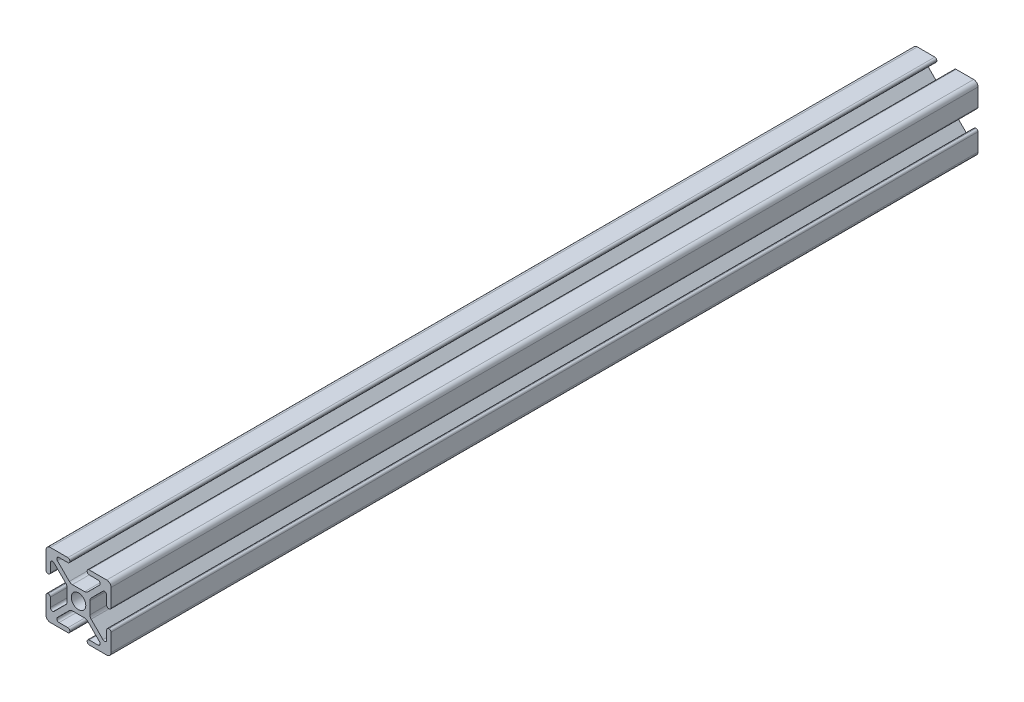
from build123d import *

# Parameters (mm, degrees)
SKETCH_1_R      = 3.35
EXTRUDE_1_DEPTH = 400


with BuildPart() as part:
    # 草图1 → 凸台-拉伸1 (new body)
    with BuildSketch(Plane.XY):
        with BuildLine():
            Line((14.1, -4), (13.9, -4))
            ThreePointArc((13.9, -4), (13.263603897, -4.263603897), (13, -4.9))
            Line((13, -4.9), (13, -8.985786438))
            ThreePointArc((13, -8.985786438), (12.382683432, -9.90966597), (11.292893219, -9.692893219))
            Line((11.292893219, -9.692893219), (5.835786438, -4.235786438))
            ThreePointArc((5.835786438, -4.235786438), (5.402240935, -3.58693974), (5.25, -2.821572875))
            Line((5.25, -2.821572875), (5.25, 2.821572875))
            ThreePointArc((5.25, 2.821572875), (5.402240935, 3.58693974), (5.835786438, 4.235786438))
            Line((5.835786438, 4.235786438), (11.292893219, 9.692893219))
            ThreePointArc((11.292893219, 9.692893219), (12.382683432, 9.90966597), (13, 8.985786438))
            Line((13, 8.985786438), (13, 4.9))
            ThreePointArc((13, 4.9), (13.263603897, 4.263603897), (13.9, 4))
            Line((13.9, 4), (14.1, 4))
            ThreePointArc((14.1, 4), (14.736396103, 4.263603897), (15, 4.9))
            Line((15, 4.9), (15, 13))
            ThreePointArc((15, 13), (14.414213562, 14.414213562), (13, 15))
            Line((13, 15), (4.9, 15))
            ThreePointArc((4.9, 15), (4.263603897, 14.736396103), (4, 14.1))
            Line((4, 14.1), (4, 13.9))
            ThreePointArc((4, 13.9), (4.263603897, 13.263603897), (4.9, 13))
            Line((4.9, 13), (8.985786438, 13))
            ThreePointArc((8.985786438, 13), (9.90966597, 12.382683432), (9.692893219, 11.292893219))
            Line((9.692893219, 11.292893219), (4.235786438, 5.835786438))
            ThreePointArc((4.235786438, 5.835786438), (3.58693974, 5.402240935), (2.821572875, 5.25))
            Line((2.821572875, 5.25), (-2.821572875, 5.25))
            ThreePointArc((-2.821572875, 5.25), (-3.58693974, 5.402240935), (-4.235786438, 5.835786438))
            Line((-4.235786438, 5.835786438), (-9.692893219, 11.292893219))
            ThreePointArc((-9.692893219, 11.292893219), (-9.90966597, 12.382683432), (-8.985786438, 13))
            Line((-8.985786438, 13), (-4.9, 13))
            ThreePointArc((-4.9, 13), (-4.263603897, 13.263603897), (-4, 13.9))
            Line((-4, 13.9), (-4, 14.1))
            ThreePointArc((-4, 14.1), (-4.263603897, 14.736396103), (-4.9, 15))
            Line((-4.9, 15), (-13, 15))
            ThreePointArc((-13, 15), (-14.414213562, 14.414213562), (-15, 13))
            Line((-15, 13), (-15, 4.9))
            ThreePointArc((-15, 4.9), (-14.736396103, 4.263603897), (-14.1, 4))
            Line((-14.1, 4), (-13.9, 4))
            ThreePointArc((-13.9, 4), (-13.263603897, 4.263603897), (-13, 4.9))
            Line((-13, 4.9), (-13, 8.985786438))
            ThreePointArc((-13, 8.985786438), (-12.382683432, 9.90966597), (-11.292893219, 9.692893219))
            Line((-11.292893219, 9.692893219), (-5.835786438, 4.235786438))
            ThreePointArc((-5.835786438, 4.235786438), (-5.402240935, 3.58693974), (-5.25, 2.821572875))
            Line((-5.25, 2.821572875), (-5.25, -2.821572875))
            ThreePointArc((-5.25, -2.821572875), (-5.402240935, -3.58693974), (-5.835786438, -4.235786438))
            Line((-5.835786438, -4.235786438), (-11.292893219, -9.692893219))
            ThreePointArc((-11.292893219, -9.692893219), (-12.382683432, -9.90966597), (-13, -8.985786438))
            Line((-13, -8.985786438), (-13, -4.9))
            ThreePointArc((-13, -4.9), (-13.263603897, -4.263603897), (-13.9, -4))
            Line((-13.9, -4), (-14.1, -4))
            ThreePointArc((-14.1, -4), (-14.736396103, -4.263603897), (-15, -4.9))
            Line((-15, -4.9), (-15, -13))
            ThreePointArc((-15, -13), (-14.414213562, -14.414213562), (-13, -15))
            Line((-13, -15), (-4.9, -15))
            ThreePointArc((-4.9, -15), (-4.263603897, -14.736396103), (-4, -14.1))
            Line((-4, -14.1), (-4, -13.9))
            ThreePointArc((-4, -13.9), (-4.263603897, -13.263603897), (-4.9, -13))
            Line((-4.9, -13), (-8.985786438, -13))
            ThreePointArc((-8.985786438, -13), (-9.90966597, -12.382683432), (-9.692893219, -11.292893219))
            Line((-9.692893219, -11.292893219), (-4.235786438, -5.835786438))
            ThreePointArc((-4.235786438, -5.835786438), (-3.58693974, -5.402240935), (-2.821572875, -5.25))
            Line((-2.821572875, -5.25), (2.821572875, -5.25))
            ThreePointArc((2.821572875, -5.25), (3.58693974, -5.402240935), (4.235786438, -5.835786438))
            Line((4.235786438, -5.835786438), (9.692893219, -11.292893219))
            ThreePointArc((9.692893219, -11.292893219), (9.90966597, -12.382683432), (8.985786438, -13))
            Line((8.985786438, -13), (4.9, -13))
            ThreePointArc((4.9, -13), (4.263603897, -13.263603897), (4, -13.9))
            Line((4, -13.9), (4, -14.1))
            ThreePointArc((4, -14.1), (4.263603897, -14.736396103), (4.9, -15))
            Line((4.9, -15), (13, -15))
            ThreePointArc((13, -15), (14.414213562, -14.414213562), (15, -13))
            Line((15, -13), (15, -4.9))
            ThreePointArc((15, -4.9), (14.736396103, -4.263603897), (14.1, -4))
        make_face()
        Circle(SKETCH_1_R, mode=Mode.SUBTRACT)
    extrude(amount=EXTRUDE_1_DEPTH)


solid = part.part
